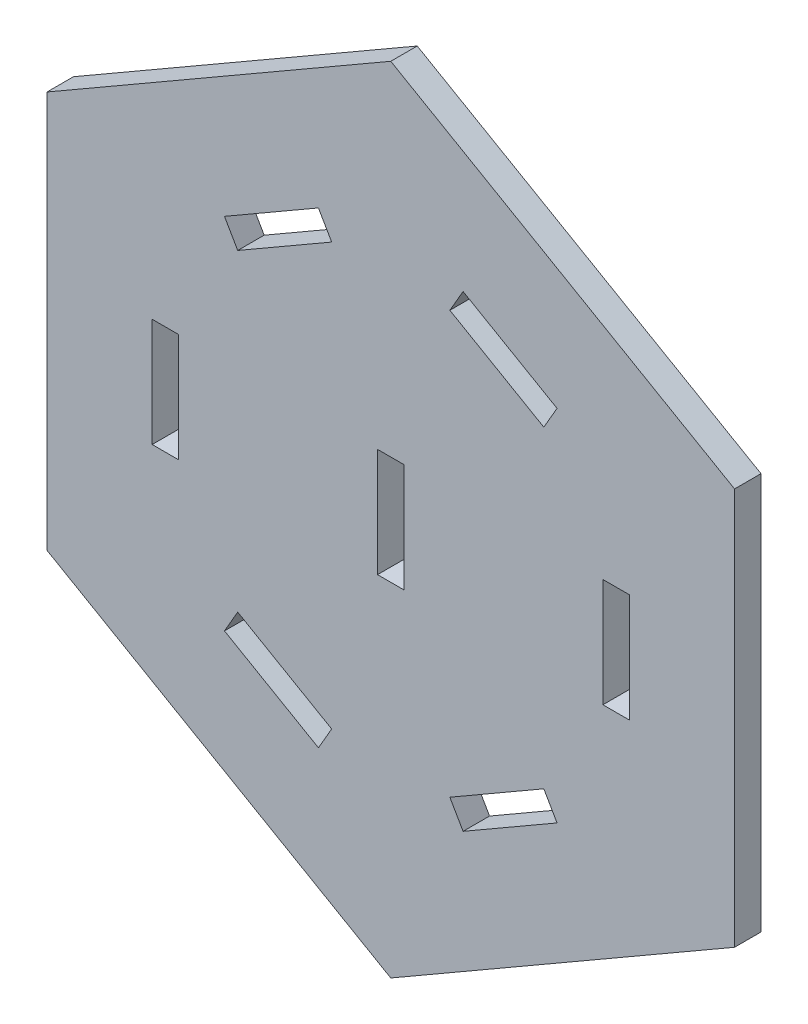
from build123d import *

# Parameters (mm, degrees)
CROQUIS1_W              = 3
CROQUIS1_H              = 12.3
SALIENTE_EXTRUIR1_DEPTH = 3


with BuildPart() as part:
    # Croquis1 → Saliente-Extruir1 (new body)
    with BuildSketch(Plane.XY):
        Polygon((307.259692282, 25.949980259), (346.230835452, 48.449980259), (346.230835452, 93.449980259), (307.259692282, 115.949980259), (268.288549111, 93.449980259), (268.288549111, 48.449980259), align=None)
        with Locations((307.259692282, 70.949980259)):
            Rectangle(CROQUIS1_W, CROQUIS1_H, mode=Mode.SUBTRACT)
        with Locations((332.809217745, 70.949980259)):
            Rectangle(CROQUIS1_W, CROQUIS1_H, mode=Mode.SUBTRACT)
        with Locations((281.710166819, 70.949980259)):
            Rectangle(CROQUIS1_W, CROQUIS1_H, mode=Mode.SUBTRACT)
        Polygon((313.95839878, 94.852480259), (324.610511247, 88.702480259), (326.110511247, 91.30055647), (315.45839878, 97.45055647), align=None, mode=Mode.SUBTRACT)
        Polygon((289.908873317, 88.702480259), (288.408873317, 91.30055647), (299.060985783, 97.45055647), (300.560985783, 94.852480259), align=None, mode=Mode.SUBTRACT)
        Polygon((300.560985783, 47.047480259), (289.908873317, 53.197480259), (288.408873317, 50.599404048), (299.060985783, 44.449404048), align=None, mode=Mode.SUBTRACT)
        Polygon((324.610511247, 53.197480259), (326.110511247, 50.599404048), (315.45839878, 44.449404048), (313.95839878, 47.047480259), align=None, mode=Mode.SUBTRACT)
    extrude(amount=SALIENTE_EXTRUIR1_DEPTH)


solid = part.part
